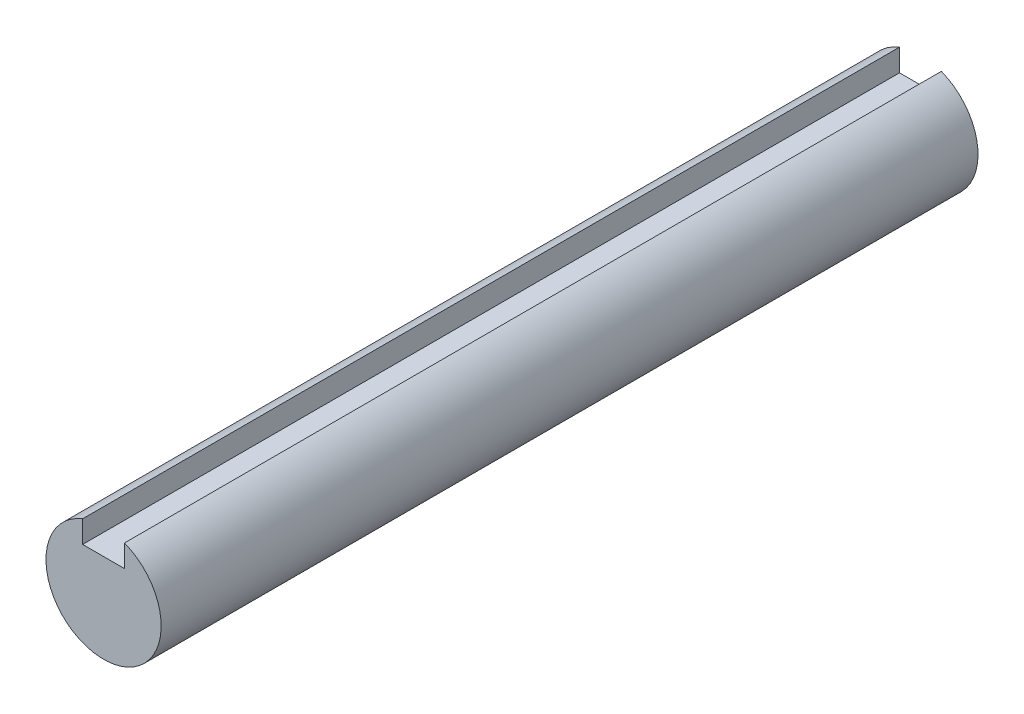
from build123d import *

# Parameters (mm, degrees)
BOSS_EXTRUDE1_DEPTH = 78


with BuildPart() as part:
    # Sketch1 → Boss-Extrude1 (new body)
    with BuildSketch(Plane.XY):
        with BuildLine():
            Line((-2, 3), (-2, 5.123475383))
            ThreePointArc((-2, 5.123475383), (-3.102418411, -4.541475531), (5.5, 0))
            ThreePointArc((5.5, 0), (4.541475531, 3.102418411), (2, 5.123475383))
            Line((2, 5.123475383), (2, 3))
            Line((2, 3), (-2, 3))
        make_face()
    extrude(amount=BOSS_EXTRUDE1_DEPTH)


solid = part.part
